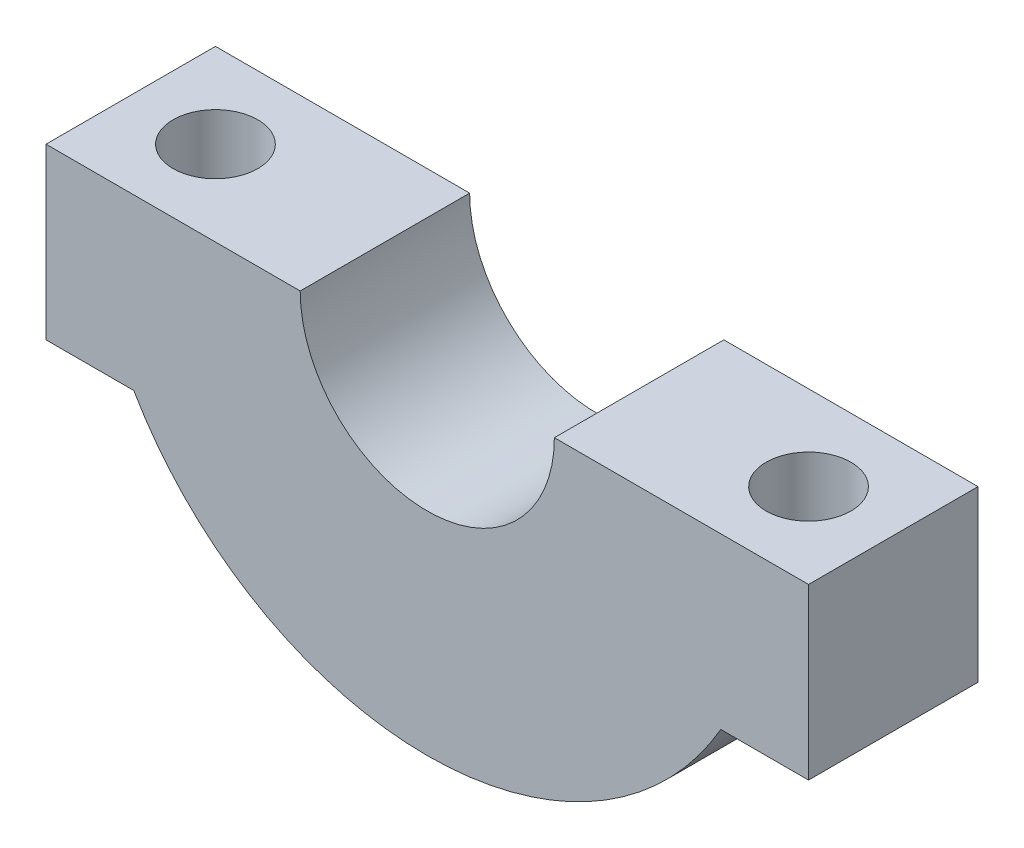
from build123d import *

# Parameters (mm, degrees)
BOSS_EXTRUDE1_DEPTH   = 20
F_1_0MM_DOWEL_HOLE1_D = 10


with BuildPart() as part:
    # Sketch1 → Boss-Extrude1 (new body)
    with BuildSketch(Plane.XY):
        with BuildLine():
            Line((15, 0), (45, 0))
            Line((45, 0), (45, -20))
            Line((45, -20), (39.423516399, -20))
            Line((39.423516399, -20), (34.641016151, -20))
            ThreePointArc((34.641016151, -20), (0, -40), (-34.641016151, -20))
            Line((-34.641016151, -20), (-39.423516399, -20))
            Line((-39.423516399, -20), (-45, -20))
            Line((-45, -20), (-45, 0))
            Line((-45, 0), (-15, 0))
            ThreePointArc((-15, 0), (0, -15), (15, 0))
        make_face()
    extrude(amount=BOSS_EXTRUDE1_DEPTH)

    # Ø1.0mm Dowel Hole1 (through all)
    with Locations(Plane(origin=(0, 0, 0), x_dir=(1, 0, 0), z_dir=(0, 1, 0))):
        with Locations((35, -10), (-35, -10)):
            Hole(F_1_0MM_DOWEL_HOLE1_D / 2)


solid = part.part
